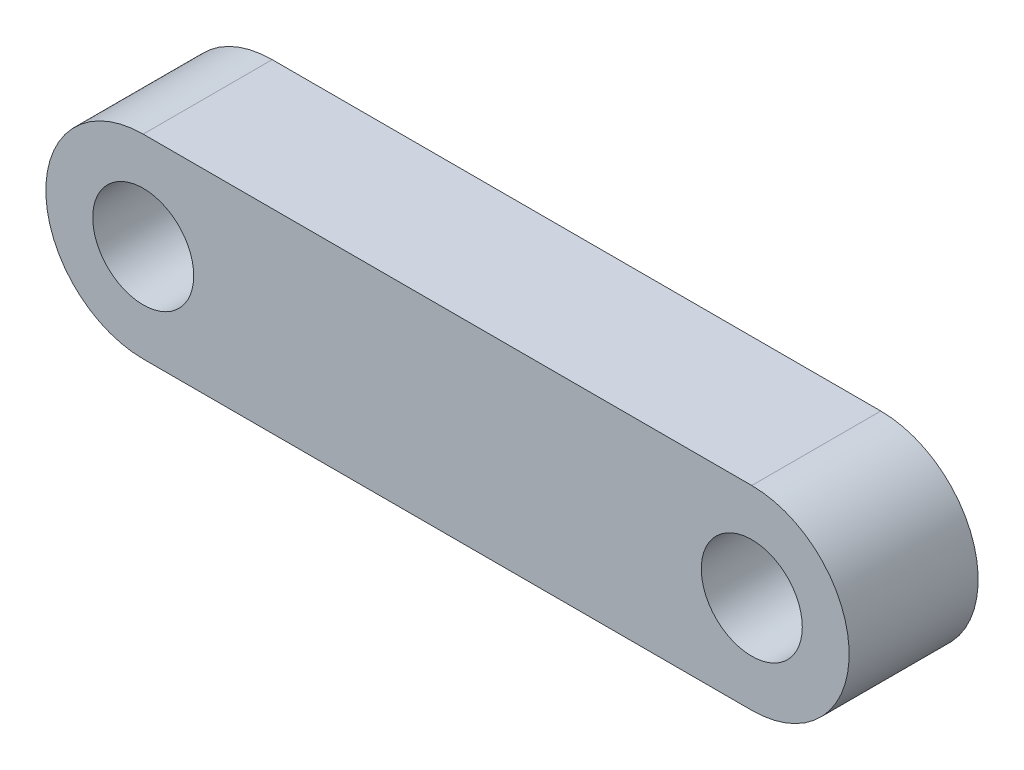
from build123d import *

# Parameters (mm, degrees)
SKETCH1_R           = 4.15
BOSS_EXTRUDE2_DEPTH = 10.6


with BuildPart() as part:
    # Sketch1 → Boss-Extrude2 (new body)
    with BuildSketch(Plane.XY):
        with BuildLine():
            Line((-25, -36.3), (25, -36.3))
            ThreePointArc((25, -36.3), (32.292866569, -31.588479467), (30.995610492, -23.003524301))
            ThreePointArc((30.995610492, -23.003524301), (28.288479467, -21.007133431), (25, -20.3))
            Line((25, -20.3), (-25, -20.3))
            ThreePointArc((-25, -20.3), (-28.288479467, -21.007133431), (-30.995610492, -23.003524301))
            ThreePointArc((-30.995610492, -23.003524301), (-32.292866569, -31.588479467), (-25, -36.3))
        make_face()
        with Locations((-25, -28.3)):
            Circle(SKETCH1_R, mode=Mode.SUBTRACT)
        with Locations((25, -28.3)):
            Circle(SKETCH1_R, mode=Mode.SUBTRACT)
    extrude(amount=-BOSS_EXTRUDE2_DEPTH)


solid = part.part
